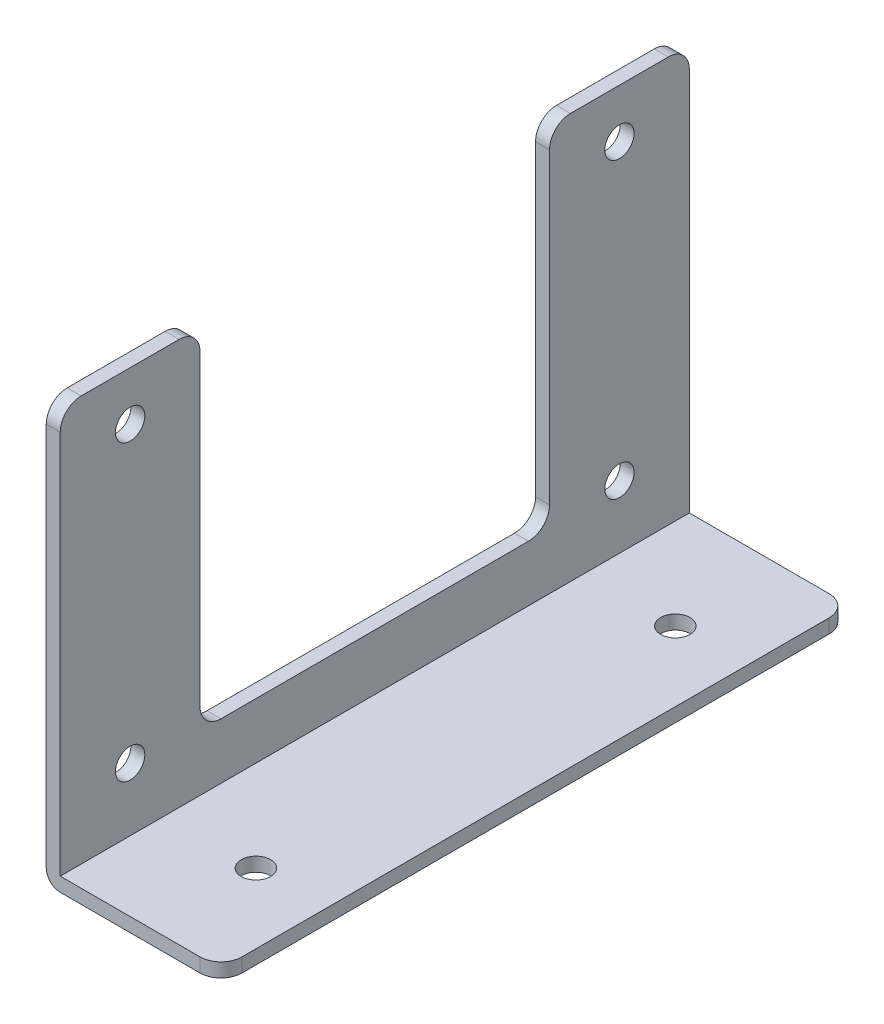
from build123d import *

# Parameters (mm, degrees)
EXTRUDE_1_DEPTH     = 45
SKETCH_2_R          = 2.1
SKETCH_2_W          = 50
SKETCH_2_H          = 50
CUT_EXTRUDE_2_DEPTH = 113.055777281
SKETCH_3_R          = 2.1
CUT_EXTRUDE_3_DEPTH = 113.055777281
FILLET_1_R          = 3


with BuildPart() as part:
    # ｽｹｯﾁ1 → ﾎﾞｽ - 押し出し1 (new, symmetric)
    with BuildSketch(Plane.XY):
        with BuildLine():
            Line((0, -39.531388125), (2, -39.531388125))
            Line((2, -39.531388125), (2, -97.531388125))
            Line((2, -97.531388125), (25, -97.531388125))
            Line((25, -97.531388125), (25, -99.531388125))
            Line((25, -99.531388125), (2, -99.531388125))
            ThreePointArc((2, -99.531388125), (0.585786438, -98.945601688), (0, -97.531388125))
            Line((0, -97.531388125), (0, -39.531388125))
        make_face()
    extrude(amount=EXTRUDE_1_DEPTH, both=True)

    # ｽｹｯﾁ2 → ｶｯﾄ - 押し出し2 (cut, through all)
    with BuildSketch(Plane(origin=(0, 0, 0), x_dir=(0, 0, -1), z_dir=(1, 0, 0))):
        with Locations(Location((-35, -46.531388125, 0), (0, 0, 270))):
            Circle(SKETCH_2_R)
        with Locations(Location((-35, -88.531388125, 0), (0, 0, 270))):
            Circle(SKETCH_2_R)
        with Locations(Location((35, -88.531388125, 0), (0, 0, 180))):
            Circle(SKETCH_2_R)
        with Locations(Location((35, -46.531388125, 0), (0, 0, 180))):
            Circle(SKETCH_2_R)
        with Locations((0, -64.531388125)):
            Rectangle(SKETCH_2_W, SKETCH_2_H)
    extrude(amount=CUT_EXTRUDE_2_DEPTH, mode=Mode.SUBTRACT)

    # ｽｹｯﾁ3 → ｶｯﾄ - 押し出し3 (cut, through all)
    with BuildSketch(Plane(origin=(0, 0, 0), x_dir=(1, 0, 0), z_dir=(0, 1, 0))):
        with Locations(Location((15, 30, 0), (0, 0, 270))):
            Circle(SKETCH_3_R)
        with Locations(Location((15, -30, 0), (0, 0, 270))):
            Circle(SKETCH_3_R)
    extrude(amount=-CUT_EXTRUDE_3_DEPTH, mode=Mode.SUBTRACT)

    # ﾌｨﾚｯﾄ1
    fillet_1_edges = [part.edges().sort_by_distance(p)[0] for p in [
        (25, -98.531388125, 45),
        (1, -39.531388125, -25),
        (1, -39.531388125, 45),
        (1, -39.531388125, 25),
        (1, -89.531388125, 25),
        (1, -89.531388125, -25),
        (1, -39.531388125, -45),
        (25, -98.531388125, -45),
    ]]
    fillet(fillet_1_edges, radius=FILLET_1_R)


solid = part.part
